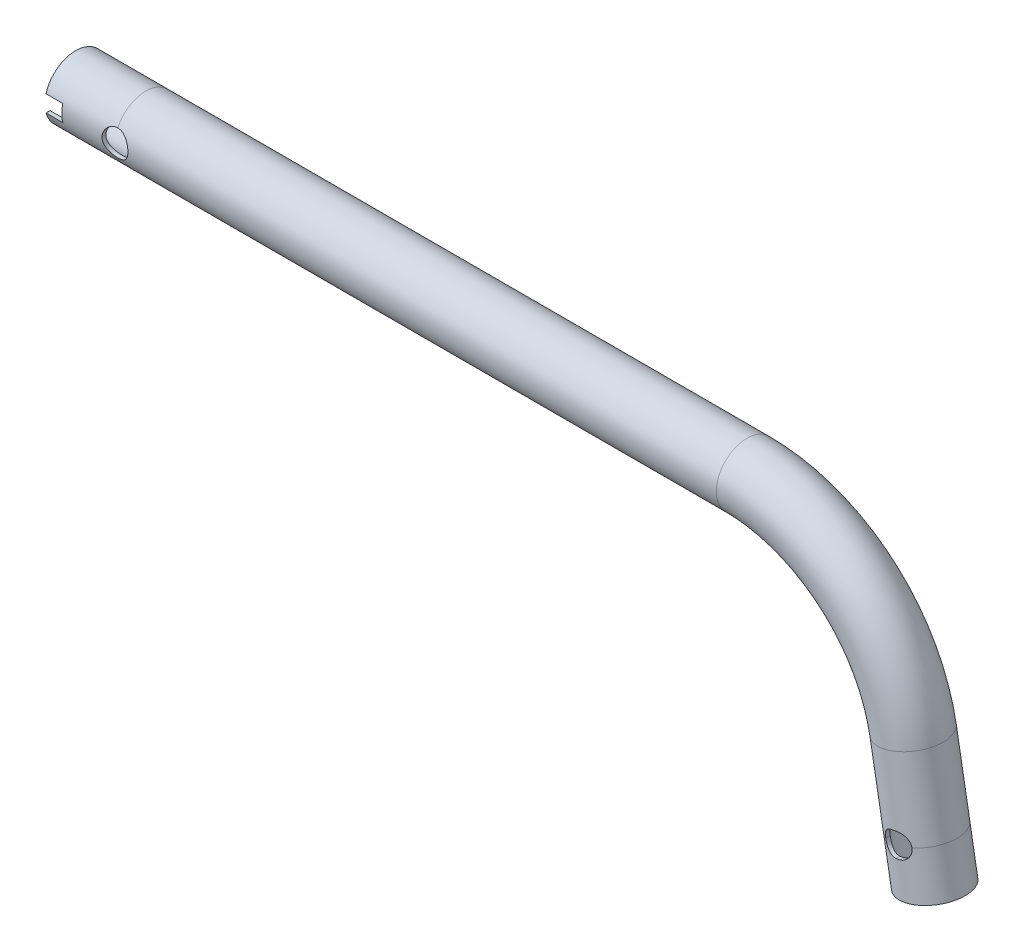
from build123d import *

# Parameters (mm, degrees)
SKETCH2_R                      = 9.5
SKETCH2_R_2                    = 8.3
CUT_EXTRUDE1_REACH             = 267.847
CUT_EXTRUDE1_DIRECTION_2_REACH = 267.847
CUT_EXTRUDE2_REACH             = 267.847
CUT_EXTRUDE2_END_RADIUS        = 9.5
SKETCH4_R                      = 4
CUT_EXTRUDE3_DEPTH             = 266.846527331
CUT_EXTRUDE3_DEPTH_BACK        = 266.846527331


with BuildPart() as part:
    # Sweep1: sweep along a path in Sketch1
    with BuildLine(Plane.XY) as sweep1_path:
        Line((-21.6, 0), (0, 0))
        Line((0, 0), (185.373442264, 0))
        ThreePointArc((185.373442264, 0), (218.798397967, -12.165688958), (236.58344542, -42.970294761))
        Line((236.58344542, -42.970294761), (240.75, -66.6))
        Line((240.75, -66.6), (243.236210428, -80.7))
    # Sketch2 → Sweep1 (sweep)
    with BuildSketch(Plane.ZY.offset(21.6)):
        Circle(SKETCH2_R)
        Circle(SKETCH2_R_2, mode=Mode.SUBTRACT)
    sweep(path=sweep1_path.line)

    # Sketch3 → Cut-Extrude1 (cut, up to next)
    with BuildSketch(Plane.XY, mode=Mode.PRIVATE) as cut_extrude1_sk1:
        with BuildLine():
            Line((244.802222036, -65.97033418), (244.773201539, -65.805750763))
            ThreePointArc((244.773201539, -65.805750763), (243.33389193, -63.54648723), (240.718605781, -62.966692249))
            Line((240.718605781, -62.966692249), (239.536836478, -63.175070062))
            ThreePointArc((239.536836478, -63.175070062), (237.277572945, -64.614379671), (236.697777964, -67.22966582))
            Line((236.697777964, -67.22966582), (236.726798461, -67.394249237))
            ThreePointArc((236.726798461, -67.394249237), (238.16610807, -69.65351277), (240.781394219, -70.233307751))
            Line((240.781394219, -70.233307751), (241.963163522, -70.024929938))
            ThreePointArc((241.963163522, -70.024929938), (244.222427055, -68.585620329), (244.802222036, -65.97033418))
        make_face()
    cut_extrude1_tool1 = extrude(cut_extrude1_sk1.sketch, amount=-CUT_EXTRUDE1_REACH, mode=Mode.PRIVATE) & part.part
    add(cut_extrude1_tool1.solids().sort_by_distance((240.75, -66.6, 0))[0], mode=Mode.SUBTRACT)

    # Sketch3 → Cut-Extrude1 direction 2 (cut, up to next)
    with BuildSketch(Plane.XY, mode=Mode.PRIVATE) as cut_extrude1_direction_2_sk1:
        with BuildLine():
            Line((244.802222036, -65.97033418), (244.773201539, -65.805750763))
            ThreePointArc((244.773201539, -65.805750763), (243.33389193, -63.54648723), (240.718605781, -62.966692249))
            Line((240.718605781, -62.966692249), (239.536836478, -63.175070062))
            ThreePointArc((239.536836478, -63.175070062), (237.277572945, -64.614379671), (236.697777964, -67.22966582))
            Line((236.697777964, -67.22966582), (236.726798461, -67.394249237))
            ThreePointArc((236.726798461, -67.394249237), (238.16610807, -69.65351277), (240.781394219, -70.233307751))
            Line((240.781394219, -70.233307751), (241.963163522, -70.024929938))
            ThreePointArc((241.963163522, -70.024929938), (244.222427055, -68.585620329), (244.802222036, -65.97033418))
        make_face()
    cut_extrude1_direction_2_tool1 = extrude(cut_extrude1_direction_2_sk1.sketch, amount=CUT_EXTRUDE1_DIRECTION_2_REACH, mode=Mode.PRIVATE) & part.part
    add(cut_extrude1_direction_2_tool1.solids().sort_by_distance((240.75, -66.6, 0))[0], mode=Mode.SUBTRACT)

    # Cut-Extrude2: up to this cylinder (the profile starts inside it)
    cut_extrude2_end = Plane(origin=(0, 0, 0), z_dir=(-1, 0, 0)) * Cylinder(CUT_EXTRUDE2_END_RADIUS, 555.694, mode=Mode.PRIVATE)
    # Sketch4 → Cut-Extrude2 (cut, up to the surface)
    with BuildSketch(Plane.XY, mode=Mode.PRIVATE) as cut_extrude2_sk1:
        with Locations(Location((0, 0, 0), (0, 0, 90))):
            Circle(SKETCH4_R)
    cut_extrude2_tool1 = extrude(cut_extrude2_sk1.sketch, amount=CUT_EXTRUDE2_REACH, mode=Mode.PRIVATE) & cut_extrude2_end
    add(cut_extrude2_tool1.solids().sort_by_distance((0, 0, 0))[0], mode=Mode.SUBTRACT)

    # Sketch5 → Cut-Extrude3 (cut, two sides: drawn at the far end of the back side and taken through both)
    with BuildSketch(Plane.XY.offset(-CUT_EXTRUDE3_DEPTH_BACK)):
        Polygon((-21.6, 0), (-21.6, 2.555), (-16.4, 2.555), (-16.4, -2.555), (-21.6, -2.555), align=None)
    extrude(amount=CUT_EXTRUDE3_DEPTH + CUT_EXTRUDE3_DEPTH_BACK, mode=Mode.SUBTRACT)


solid = part.part
